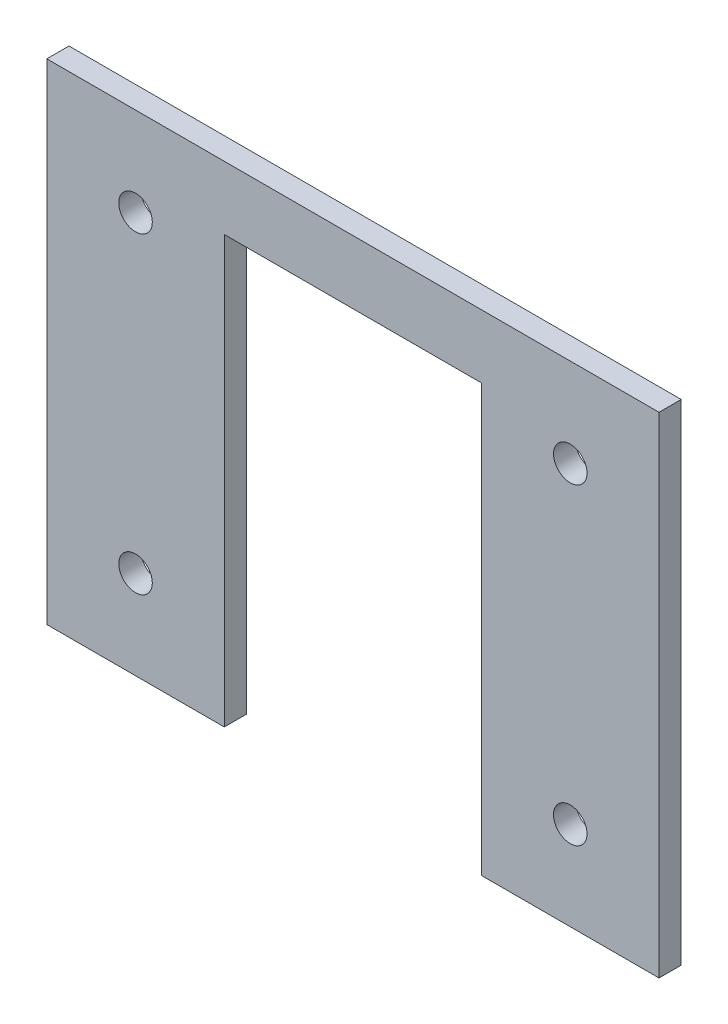
from build123d import *

# Parameters (mm, degrees)
SKETCH1_R            = 1.091149581
SKETCH1_R_2          = 1.265238112
SKETCH1_R_3          = 1.717110749
SKETCH1_R_4          = 1.455402606
BOSS_EXTRUDE1_DEPTH  = 3.175
M4_CLEARANCE_HOLE1_D = 4.8


with BuildPart() as part:
    # Sketch1 → Boss-Extrude1 (new body)
    with BuildSketch(Plane.XY):
        Polygon((11.503555024, -3.77372269), (36.903555024, -3.77372269), (36.903555024, 57.275941722), (73.723553593, 57.275941722), (73.723553593, -3.77372269), (99.123553593, -3.77372269), (99.123553593, 66.34627731), (73.723553593, 66.34627731), (36.903555024, 66.34627731), (11.503555024, 66.34627731), align=None)
        with Locations((24.203555024, 53.64627731)):
            Circle(SKETCH1_R, mode=Mode.SUBTRACT)
        with Locations((24.203555024, 8.92627731)):
            Circle(SKETCH1_R_2, mode=Mode.SUBTRACT)
        with Locations((86.423553593, 53.64627731)):
            Circle(SKETCH1_R_3, mode=Mode.SUBTRACT)
        with Locations((86.423553593, 8.92627731)):
            Circle(SKETCH1_R_4, mode=Mode.SUBTRACT)
    extrude(amount=BOSS_EXTRUDE1_DEPTH)

    # M4 Clearance Hole1 (through all)
    with Locations(Plane.XY.offset(3.175)):
        with Locations((24.203555024, 53.64627731), (24.203555024, 8.92627731), (86.423553593, 8.92627731), (86.423553593, 53.64627731)):
            Hole(M4_CLEARANCE_HOLE1_D / 2)


solid = part.part
